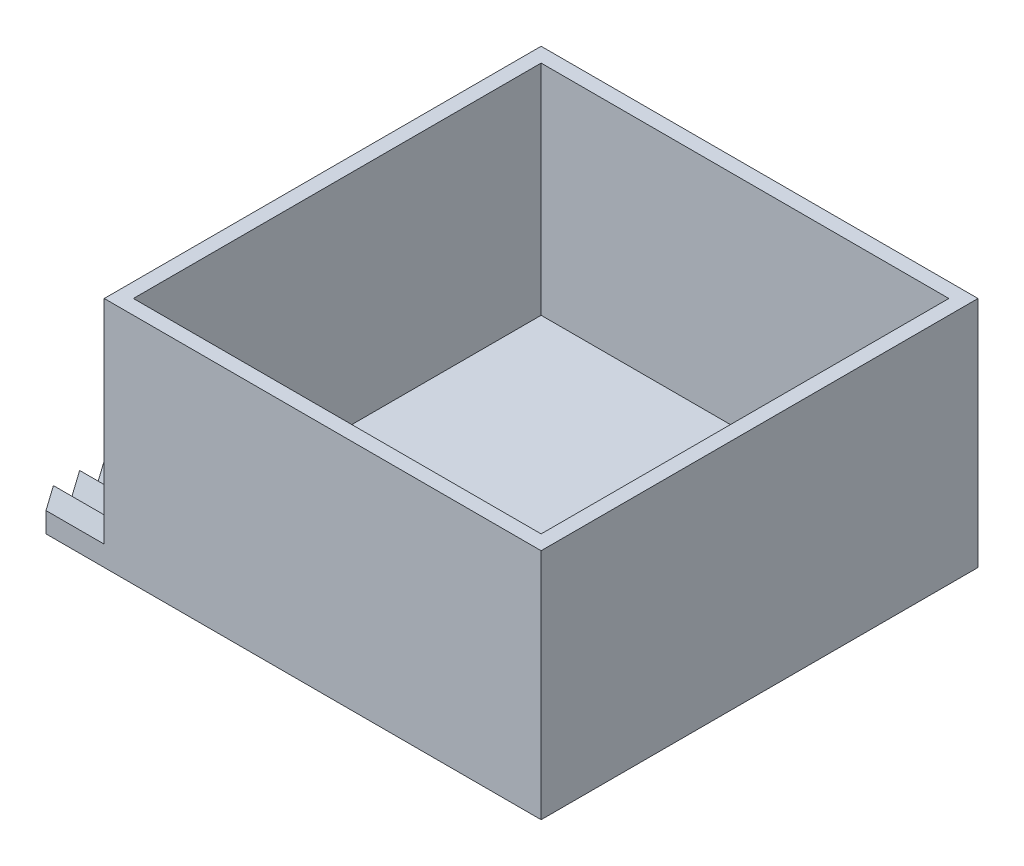
from build123d import *

# Parameters (mm, degrees)
SKETCH1_W           = 15
SKETCH1_H           = 15
BOSS_EXTRUDE1_DEPTH = 8
SHELL6_T            = -0.5
BOSS_EXTRUDE3_DEPTH = 2


with BuildPart() as part:
    # Sketch1 → Boss-Extrude1 (new body)
    with BuildSketch(Plane(origin=(0, 0, 0), x_dir=(1, 0, 0), z_dir=(0, 1, 0))):
        Rectangle(SKETCH1_W, SKETCH1_H)
    extrude(amount=BOSS_EXTRUDE1_DEPTH)

    # Shell6
    shell6_openings = [part.faces().sort_by_distance(p)[0] for p in [
        (0, 8, 0),
    ]]
    offset(amount=SHELL6_T, openings=shell6_openings, kind=Kind.INTERSECTION)

    # Sketch2 → Boss-Extrude3 (add)
    with BuildSketch(Plane.ZY.offset(7.5)):
        Polygon((-7.5, 0), (7.5, 0), (7.5, 0.5), (7.5, 0.693696827), (7.245384733, 1.309388279), (6.9, 0.5), (6.680102085, 0.5), (6.345384733, 1.309388279), (6, 0.5), (5.780102085, 0.5), (5.445384733, 1.309388279), (5.1, 0.5), (4.880102085, 0.5), (4.545384733, 1.309388279), (4.2, 0.5), (3.980102085, 0.5), (3.645384733, 1.309388279), (3.3, 0.5), (3.080102085, 0.5), (2.745384733, 1.309388279), (2.4, 0.5), (2.180102085, 0.5), (1.845384733, 1.309388279), (1.5, 0.5), (1.280102085, 0.5), (0.945384733, 1.309388279), (0.6, 0.5), (0.380102085, 0.5), (0.045384733, 1.309388279), (-0.3, 0.5), (-0.519897915, 0.5), (-0.854615267, 1.309388279), (-1.2, 0.5), (-1.419897915, 0.5), (-1.754615267, 1.309388279), (-2.1, 0.5), (-2.319897915, 0.5), (-2.654615267, 1.309388279), (-3, 0.5), (-3.219897915, 0.5), (-3.554615267, 1.309388279), (-3.9, 0.5), (-4.119897915, 0.5), (-4.454615267, 1.309388279), (-4.8, 0.5), (-5.019897915, 0.5), (-5.354615267, 1.309388279), (-5.7, 0.5), (-5.919897915, 0.5), (-6.254615267, 1.309388279), (-6.6, 0.5), (-6.819897915, 0.5), (-7.154615267, 1.309388279), (-7.5, 0.5), align=None)
    extrude(amount=BOSS_EXTRUDE3_DEPTH)


solid = part.part
